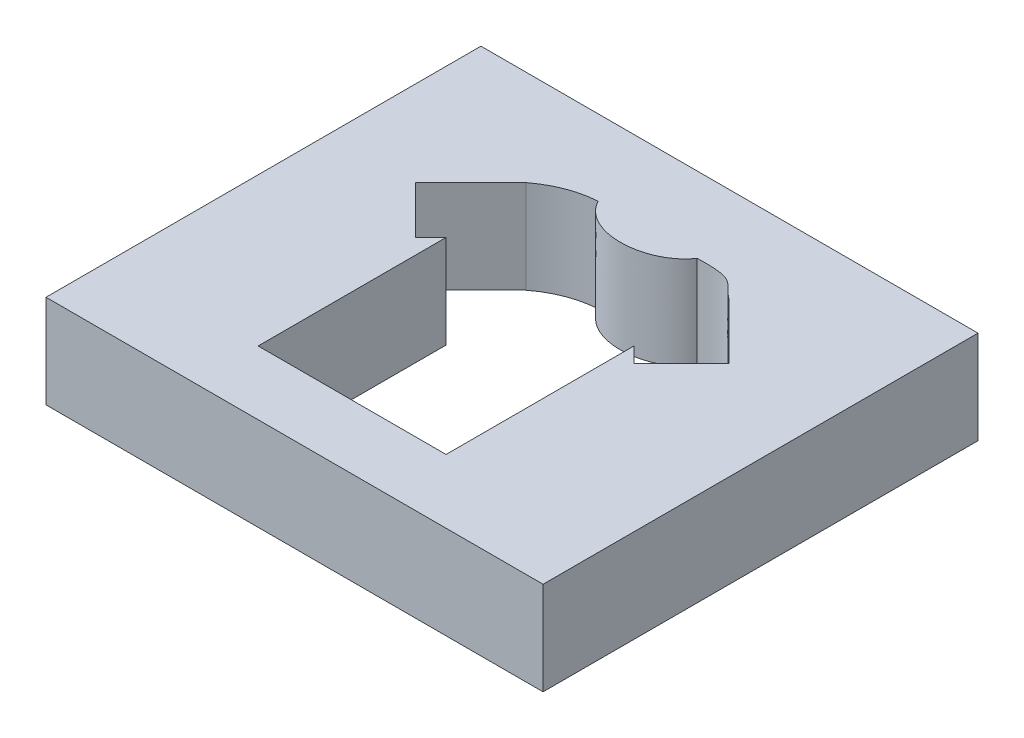
from build123d import *

# Parameters (mm, degrees)
SKETCH1_W           = 16
SKETCH1_H           = 14
BOSS_EXTRUDE1_DEPTH = 3


with BuildPart() as part:
    # Sketch1 → Boss-Extrude1 (new body)
    with BuildSketch(Plane(origin=(0, 0, 0), x_dir=(1, 0, 0), z_dir=(0, 1, 0))):
        with Locations((-34.802547771, 15.318471338)):
            Rectangle(SKETCH1_W, SKETCH1_H)
        with BuildLine():
            Line((-40.05451323, 17.459486991), (-38.524659604, 15.929633365))
            Line((-38.524659604, 15.929633365), (-38.030399201, 16.423893767))
            Line((-38.030399201, 16.423893767), (-38.030399201, 10.37508789))
            Line((-38.030399201, 10.37508789), (-31.981593325, 10.37508789))
            Line((-31.981593325, 10.37508789), (-31.981593325, 16.423893767))
            Line((-31.981593325, 16.423893767), (-31.487332922, 15.929633365))
            Line((-31.487332922, 15.929633365), (-29.957479296, 17.459486991))
            Line((-29.957479296, 17.459486991), (-31.734463123, 19.236470819))
            add(Edge.make_bspline(
                [(-31.734463123, 19.236470819), (-32.317966026, 19.664517133), (-32.090545187, 19.92760941), (-33.406999381, 19.883716584)],
                knots=[0, 0, 0, 0, 1, 1, 1, 1], degree=3))
            add(Edge.make_bspline(
                [(-36.594690414, 19.883716584), (-36.00950924, 18.767110628), (-34.074320208, 18.900131332), (-33.406999381, 19.883716584)],
                knots=[0, 0, 0, 0, 1, 1, 1, 1], degree=3))
            add(Edge.make_bspline(
                [(-38.277529403, 19.236470819), (-37.529085744, 19.813493214), (-36.594690414, 19.883716584)],
                knots=[0, 0, 0, 1, 1, 1], degree=2))
            Line((-38.277529403, 19.236470819), (-40.05451323, 17.459486991))
        make_face(mode=Mode.SUBTRACT)
    extrude(amount=BOSS_EXTRUDE1_DEPTH)


solid = part.part
